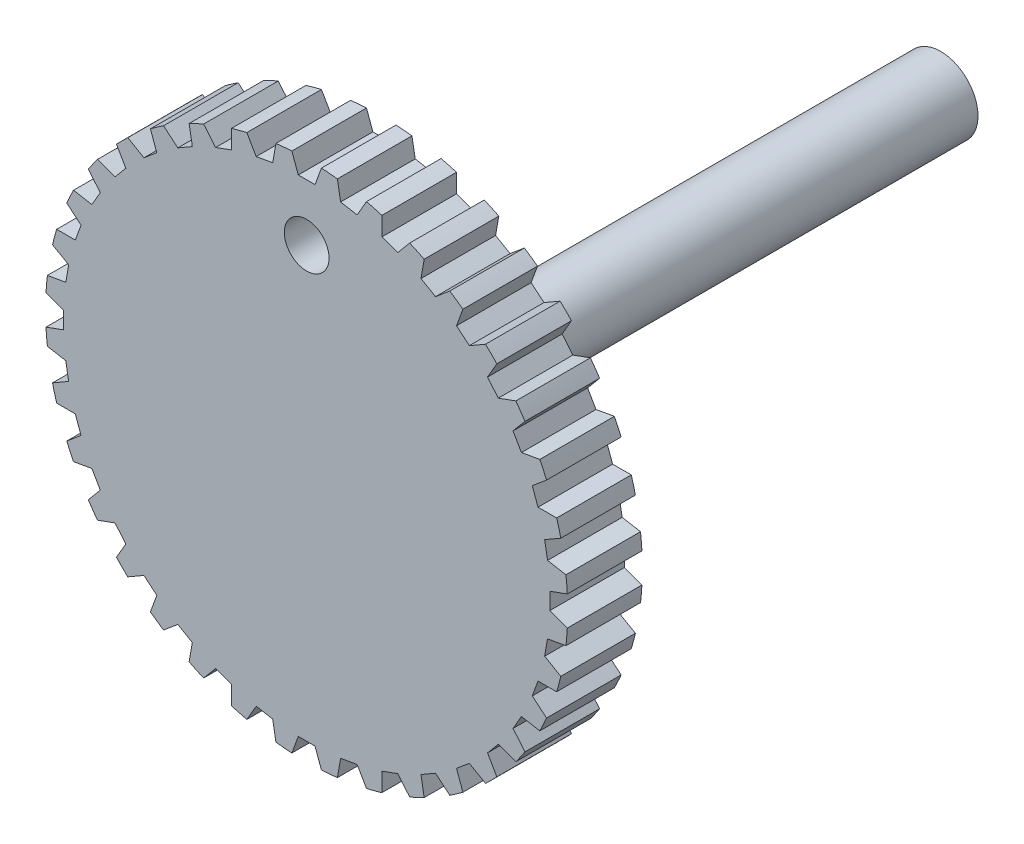
from build123d import *

# Parameters (mm, degrees)
BOSS_EXTRUDE1_DEPTH = 20
SKETCH2_R           = 10
BOSS_EXTRUDE2_DEPTH = 150
SKETCH3_R           = 6
CUT_EXTRUDE1_DEPTH  = 197.643421463


with BuildPart() as part:
    # Sketch1 → Boss-Extrude1 (new body)
    with BuildSketch(Plane.XY):
        with BuildLine():
            Line((-3.960100717, 69.887893103), (-2.25, 65.189429999))
            Line((-2.25, 65.189429999), (2.25, 65.189429999))
            Line((2.25, 65.189429999), (3.960100717, 69.887893103))
            ThreePointArc((3.960100717, 69.887893103), (6.100901992, 69.733628866), (8.23596739, 69.513803242))
            Line((8.23596739, 69.513803242), (9.104208278, 64.589764477))
            Line((9.104208278, 64.589764477), (13.535843167, 63.808347677))
            Line((13.535843167, 63.808347677), (16.035843167, 68.138474696))
            ThreePointArc((16.035843167, 68.138474696), (18.117333157, 67.61480784), (20.181789795, 67.027571645))
            Line((20.181789795, 67.027571645), (20.181789795, 62.027571645))
            Line((20.181789795, 62.027571645), (24.410406588, 60.488481))
            Line((24.410406588, 60.488481), (27.624344637, 64.318703216))
            ThreePointArc((27.624344637, 64.318703216), (29.583278322, 63.441545093), (31.514398729, 62.504741202))
            Line((31.514398729, 62.504741202), (30.646157841, 57.580702437))
            Line((30.646157841, 57.580702437), (34.543272158, 55.330702437))
            Line((34.543272158, 55.330702437), (38.373494373, 58.544640485))
            ThreePointArc((38.373494373, 58.544640485), (40.150350545, 57.3406431), (41.889458605, 56.082735826))
            Line((41.889458605, 56.082735826), (40.179357889, 51.384272722))
            Line((40.179357889, 51.384272722), (43.626557883, 48.491728479))
            Line((43.626557883, 48.491728479), (47.956684902, 50.991728479))
            ThreePointArc((47.956684902, 50.991728479), (49.497474683, 49.497474683), (50.991728479, 47.956684902))
            Line((50.991728479, 47.956684902), (48.491728479, 43.626557883))
            Line((48.491728479, 43.626557883), (51.384272722, 40.179357889))
            Line((51.384272722, 40.179357889), (56.082735826, 41.889458605))
            ThreePointArc((56.082735826, 41.889458605), (57.3406431, 40.150350545), (58.544640485, 38.373494373))
            Line((58.544640485, 38.373494373), (55.330702437, 34.543272158))
            Line((55.330702437, 34.543272158), (57.580702437, 30.646157841))
            Line((57.580702437, 30.646157841), (62.504741202, 31.514398729))
            ThreePointArc((62.504741202, 31.514398729), (63.441545093, 29.583278322), (64.318703216, 27.624344637))
            Line((64.318703216, 27.624344637), (60.488481, 24.410406588))
            Line((60.488481, 24.410406588), (62.027571645, 20.181789795))
            Line((62.027571645, 20.181789795), (67.027571645, 20.181789795))
            ThreePointArc((67.027571645, 20.181789795), (67.61480784, 18.117333157), (68.138474696, 16.035843167))
            Line((68.138474696, 16.035843167), (63.808347677, 13.535843167))
            Line((63.808347677, 13.535843167), (64.589764477, 9.104208278))
            Line((64.589764477, 9.104208278), (69.513803242, 8.23596739))
            ThreePointArc((69.513803242, 8.23596739), (69.733628866, 6.100901992), (69.887893103, 3.960100717))
            Line((69.887893103, 3.960100717), (65.189429999, 2.25))
            Line((65.189429999, 2.25), (65.189429999, -2.25))
            Line((65.189429999, -2.25), (69.887893103, -3.960100717))
            ThreePointArc((69.887893103, -3.960100717), (69.733628866, -6.100901992), (69.513803242, -8.23596739))
            Line((69.513803242, -8.23596739), (64.589764477, -9.104208278))
            Line((64.589764477, -9.104208278), (63.808347677, -13.535843167))
            Line((63.808347677, -13.535843167), (68.138474696, -16.035843167))
            ThreePointArc((68.138474696, -16.035843167), (67.61480784, -18.117333157), (67.027571645, -20.181789795))
            Line((67.027571645, -20.181789795), (62.027571645, -20.181789795))
            Line((62.027571645, -20.181789795), (60.488481, -24.410406588))
            Line((60.488481, -24.410406588), (64.318703216, -27.624344637))
            ThreePointArc((64.318703216, -27.624344637), (63.441545093, -29.583278322), (62.504741202, -31.514398729))
            Line((62.504741202, -31.514398729), (57.580702437, -30.646157841))
            Line((57.580702437, -30.646157841), (55.330702437, -34.543272158))
            Line((55.330702437, -34.543272158), (58.544640485, -38.373494373))
            ThreePointArc((58.544640485, -38.373494373), (57.3406431, -40.150350545), (56.082735826, -41.889458605))
            Line((56.082735826, -41.889458605), (51.384272722, -40.179357889))
            Line((51.384272722, -40.179357889), (48.491728479, -43.626557883))
            Line((48.491728479, -43.626557883), (50.991728479, -47.956684902))
            ThreePointArc((50.991728479, -47.956684902), (49.497474683, -49.497474683), (47.956684902, -50.991728479))
            Line((47.956684902, -50.991728479), (43.626557883, -48.491728479))
            Line((43.626557883, -48.491728479), (40.179357889, -51.384272722))
            Line((40.179357889, -51.384272722), (41.889458605, -56.082735826))
            ThreePointArc((41.889458605, -56.082735826), (40.150350545, -57.3406431), (38.373494373, -58.544640485))
            Line((38.373494373, -58.544640485), (34.543272158, -55.330702437))
            Line((34.543272158, -55.330702437), (30.646157841, -57.580702437))
            Line((30.646157841, -57.580702437), (31.514398729, -62.504741202))
            ThreePointArc((31.514398729, -62.504741202), (29.583278322, -63.441545093), (27.624344637, -64.318703216))
            Line((27.624344637, -64.318703216), (24.410406588, -60.488481))
            Line((24.410406588, -60.488481), (20.181789795, -62.027571645))
            Line((20.181789795, -62.027571645), (20.181789795, -67.027571645))
            ThreePointArc((20.181789795, -67.027571645), (18.117333157, -67.61480784), (16.035843167, -68.138474696))
            Line((16.035843167, -68.138474696), (13.535843167, -63.808347677))
            Line((13.535843167, -63.808347677), (9.104208278, -64.589764477))
            Line((9.104208278, -64.589764477), (8.23596739, -69.513803242))
            ThreePointArc((8.23596739, -69.513803242), (6.100901992, -69.733628866), (3.960100717, -69.887893103))
            Line((3.960100717, -69.887893103), (2.25, -65.189429999))
            Line((2.25, -65.189429999), (-2.25, -65.189429999))
            Line((-2.25, -65.189429999), (-3.960100717, -69.887893103))
            ThreePointArc((-3.960100717, -69.887893103), (-6.100901992, -69.733628866), (-8.23596739, -69.513803242))
            Line((-8.23596739, -69.513803242), (-9.104208278, -64.589764477))
            Line((-9.104208278, -64.589764477), (-13.535843167, -63.808347677))
            Line((-13.535843167, -63.808347677), (-16.035843167, -68.138474696))
            ThreePointArc((-16.035843167, -68.138474696), (-18.117333157, -67.61480784), (-20.181789795, -67.027571645))
            Line((-20.181789795, -67.027571645), (-20.181789795, -62.027571645))
            Line((-20.181789795, -62.027571645), (-24.410406588, -60.488481))
            Line((-24.410406588, -60.488481), (-27.624344637, -64.318703216))
            ThreePointArc((-27.624344637, -64.318703216), (-29.583278322, -63.441545093), (-31.514398729, -62.504741202))
            Line((-31.514398729, -62.504741202), (-30.646157841, -57.580702437))
            Line((-30.646157841, -57.580702437), (-34.543272158, -55.330702437))
            Line((-34.543272158, -55.330702437), (-38.373494373, -58.544640485))
            ThreePointArc((-38.373494373, -58.544640485), (-40.150350545, -57.3406431), (-41.889458605, -56.082735826))
            Line((-41.889458605, -56.082735826), (-40.179357889, -51.384272722))
            Line((-40.179357889, -51.384272722), (-43.626557883, -48.491728479))
            Line((-43.626557883, -48.491728479), (-47.956684902, -50.991728479))
            ThreePointArc((-47.956684902, -50.991728479), (-49.497474683, -49.497474683), (-50.991728479, -47.956684902))
            Line((-50.991728479, -47.956684902), (-48.491728479, -43.626557883))
            Line((-48.491728479, -43.626557883), (-51.384272722, -40.179357889))
            Line((-51.384272722, -40.179357889), (-56.082735826, -41.889458605))
            ThreePointArc((-56.082735826, -41.889458605), (-57.3406431, -40.150350545), (-58.544640485, -38.373494373))
            Line((-58.544640485, -38.373494373), (-55.330702437, -34.543272158))
            Line((-55.330702437, -34.543272158), (-57.580702437, -30.646157841))
            Line((-57.580702437, -30.646157841), (-62.504741202, -31.514398729))
            ThreePointArc((-62.504741202, -31.514398729), (-63.441545093, -29.583278322), (-64.318703216, -27.624344637))
            Line((-64.318703216, -27.624344637), (-60.488481, -24.410406588))
            Line((-60.488481, -24.410406588), (-62.027571645, -20.181789795))
            Line((-62.027571645, -20.181789795), (-67.027571645, -20.181789795))
            ThreePointArc((-67.027571645, -20.181789795), (-67.61480784, -18.117333157), (-68.138474696, -16.035843167))
            Line((-68.138474696, -16.035843167), (-63.808347677, -13.535843167))
            Line((-63.808347677, -13.535843167), (-64.589764477, -9.104208278))
            Line((-64.589764477, -9.104208278), (-69.513803242, -8.23596739))
            ThreePointArc((-69.513803242, -8.23596739), (-69.733628866, -6.100901992), (-69.887893103, -3.960100717))
            Line((-69.887893103, -3.960100717), (-65.189429999, -2.25))
            Line((-65.189429999, -2.25), (-65.189429999, 2.25))
            Line((-65.189429999, 2.25), (-69.887893103, 3.960100717))
            ThreePointArc((-69.887893103, 3.960100717), (-69.733628866, 6.100901992), (-69.513803242, 8.23596739))
            Line((-69.513803242, 8.23596739), (-64.589764477, 9.104208278))
            Line((-64.589764477, 9.104208278), (-63.808347677, 13.535843167))
            Line((-63.808347677, 13.535843167), (-68.138474696, 16.035843167))
            ThreePointArc((-68.138474696, 16.035843167), (-67.61480784, 18.117333157), (-67.027571645, 20.181789795))
            Line((-67.027571645, 20.181789795), (-62.027571645, 20.181789795))
            Line((-62.027571645, 20.181789795), (-60.488481, 24.410406588))
            Line((-60.488481, 24.410406588), (-64.318703216, 27.624344637))
            ThreePointArc((-64.318703216, 27.624344637), (-63.441545093, 29.583278322), (-62.504741202, 31.514398729))
            Line((-62.504741202, 31.514398729), (-57.580702437, 30.646157841))
            Line((-57.580702437, 30.646157841), (-55.330702437, 34.543272158))
            Line((-55.330702437, 34.543272158), (-58.544640485, 38.373494373))
            ThreePointArc((-58.544640485, 38.373494373), (-57.3406431, 40.150350545), (-56.082735826, 41.889458605))
            Line((-56.082735826, 41.889458605), (-51.384272722, 40.179357889))
            Line((-51.384272722, 40.179357889), (-48.491728479, 43.626557883))
            Line((-48.491728479, 43.626557883), (-50.991728479, 47.956684902))
            ThreePointArc((-50.991728479, 47.956684902), (-49.497474683, 49.497474683), (-47.956684902, 50.991728479))
            Line((-47.956684902, 50.991728479), (-43.626557883, 48.491728479))
            Line((-43.626557883, 48.491728479), (-40.179357889, 51.384272722))
            Line((-40.179357889, 51.384272722), (-41.889458605, 56.082735826))
            ThreePointArc((-41.889458605, 56.082735826), (-40.150350545, 57.3406431), (-38.373494373, 58.544640485))
            Line((-38.373494373, 58.544640485), (-34.543272158, 55.330702437))
            Line((-34.543272158, 55.330702437), (-30.646157841, 57.580702437))
            Line((-30.646157841, 57.580702437), (-31.514398729, 62.504741202))
            ThreePointArc((-31.514398729, 62.504741202), (-29.583278322, 63.441545093), (-27.624344637, 64.318703216))
            Line((-27.624344637, 64.318703216), (-24.410406588, 60.488481))
            Line((-24.410406588, 60.488481), (-20.181789795, 62.027571645))
            Line((-20.181789795, 62.027571645), (-20.181789795, 67.027571645))
            ThreePointArc((-20.181789795, 67.027571645), (-18.117333157, 67.61480784), (-16.035843167, 68.138474696))
            Line((-16.035843167, 68.138474696), (-13.535843167, 63.808347677))
            Line((-13.535843167, 63.808347677), (-9.104208278, 64.589764477))
            Line((-9.104208278, 64.589764477), (-8.23596739, 69.513803242))
            ThreePointArc((-8.23596739, 69.513803242), (-6.100901992, 69.733628866), (-3.960100717, 69.887893103))
        make_face()
    extrude(amount=BOSS_EXTRUDE1_DEPTH)

    # Sketch2 → Boss-Extrude2 (add)
    with BuildSketch(Plane.XY):
        Circle(SKETCH2_R)
    extrude(amount=-BOSS_EXTRUDE2_DEPTH)

    # Sketch3 → Cut-Extrude1 (cut, through all)
    with BuildSketch(Plane.XY.offset(20)):
        with Locations((0, 50)):
            Circle(SKETCH3_R)
    extrude(amount=-CUT_EXTRUDE1_DEPTH, mode=Mode.SUBTRACT)


solid = part.part
